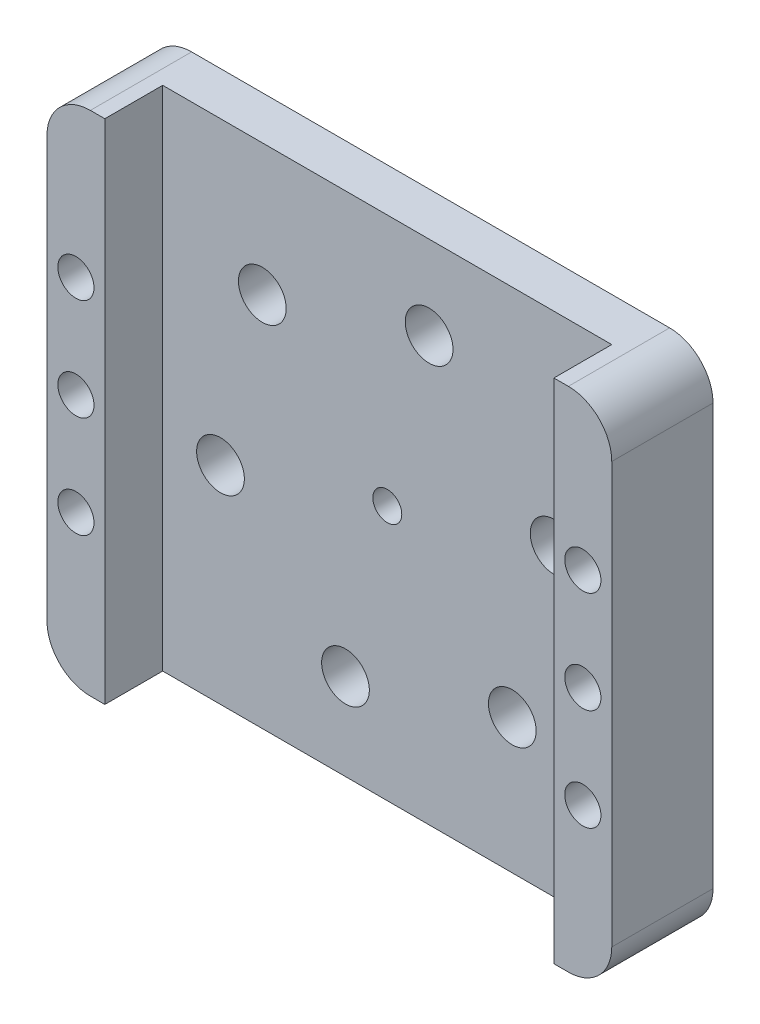
from build123d import *

# Parameters (mm, degrees)
SKETCH_3_R          = 1.65
EXTRUDE_2_DEPTH     = 3
SKETCH_4_W          = 4
SKETCH_4_H          = 35.070805957
SKETCH_4_R          = 1.25
EXTRUDE_3_DEPTH     = 4
CUT_EXTRUDE_START   = -10
SKETCH_5_R          = 1
SKETCH_5_R_2        = 1.25
CUT_EXTRUDE_1_DEPTH = 10
FILLET_1_R          = 3
FILLET_2_R          = 3
FILLET_3_R          = 3
FILLET_4_R          = 3


with BuildPart() as part:
    # 草图3 → 凸台-拉伸2 (new body)
    with BuildSketch(Plane.XY):
        Polygon((-35.565841924, 57.58934902), (-72.610989278, 57.58934902), (-73.610989278, 57.58934902), (-73.610989278, 22.518543063), (-72.610989278, 22.518543063), (-35.565841924, 22.518543063), (-34.565841924, 22.518543063), (-34.565841924, 57.58934902), align=None)
        with Locations((-56.974581146, 28.517016942)):
            Circle(SKETCH_3_R, mode=Mode.SUBTRACT)
        with Locations((-65.61538335, 36.843873328)):
            Circle(SKETCH_3_R, mode=Mode.SUBTRACT)
        with Locations((-45.44291088, 31.836742967)):
            Circle(SKETCH_3_R, mode=Mode.SUBTRACT)
        with Locations((-62.724515288, 48.490455739)):
            Circle(SKETCH_3_R, mode=Mode.SUBTRACT)
        with Locations((-42.552042818, 43.483325377)):
            Circle(SKETCH_3_R, mode=Mode.SUBTRACT)
        with Locations((-51.192845022, 51.810181763)):
            Circle(SKETCH_3_R, mode=Mode.SUBTRACT)
    extrude(amount=EXTRUDE_2_DEPTH)

    # 草图4 → 凸台-拉伸3 (add)
    # profile 1 of 2: a face of its own
    with BuildSketch(Plane.XY.offset(3)):
        with Locations((-71.610989278, 40.053946041)):
            Rectangle(SKETCH_4_W, SKETCH_4_H)
        with Locations((-71.610989278, 47.08934902)):
            Circle(SKETCH_4_R, mode=Mode.SUBTRACT)
        with Locations((-71.610989278, 33.018543063)):
            Circle(SKETCH_4_R, mode=Mode.SUBTRACT)
        with Locations((-71.610989278, 40.053946042)):
            Circle(SKETCH_4_R, mode=Mode.SUBTRACT)
    # profile 2 of 2: a face of its own
    with BuildSketch(Plane.XY.offset(3)):
        with Locations((-36.565841924, 40.053946041)):
            Rectangle(SKETCH_4_W, SKETCH_4_H)
        with Locations((-36.565841924, 47.08934902)):
            Circle(SKETCH_4_R, mode=Mode.SUBTRACT)
        with Locations((-36.565841924, 40.053946042)):
            Circle(SKETCH_4_R, mode=Mode.SUBTRACT)
        with Locations((-36.565841924, 33.018543063)):
            Circle(SKETCH_4_R, mode=Mode.SUBTRACT)
    extrude(amount=EXTRUDE_3_DEPTH)

    # 草图5 → 切除-拉伸1 (cut)
    with BuildSketch(Plane.XY.offset(3).offset(CUT_EXTRUDE_START)):
        with Locations((-54.083713084, 40.163599353)):
            Circle(SKETCH_5_R)
        with Locations((-71.610989278, 47.08934902)):
            Circle(SKETCH_5_R_2)
        with Locations((-71.610989278, 40.053946042)):
            Circle(SKETCH_5_R_2)
        with Locations((-71.610989278, 33.018543063)):
            Circle(SKETCH_5_R_2)
        with Locations((-36.565841924, 47.08934902)):
            Circle(SKETCH_5_R_2)
        with Locations((-36.565841924, 40.053946042)):
            Circle(SKETCH_5_R_2)
        with Locations((-36.565841924, 33.018543063)):
            Circle(SKETCH_5_R_2)
    extrude(amount=CUT_EXTRUDE_1_DEPTH, mode=Mode.SUBTRACT)

    # 圆角1
    fillet_1_edges = [part.edges().sort_by_distance(p)[0] for p in [
        (-73.610989278, 22.518543063, 3.5),
    ]]
    fillet(fillet_1_edges, radius=FILLET_1_R)

    # 圆角2
    fillet_2_edges = [part.edges().sort_by_distance(p)[0] for p in [
        (-73.610989278, 57.58934902, 3.5),
    ]]
    fillet(fillet_2_edges, radius=FILLET_2_R)

    # 圆角3
    fillet_3_edges = [part.edges().sort_by_distance(p)[0] for p in [
        (-34.565841924, 57.58934902, 3.5),
    ]]
    fillet(fillet_3_edges, radius=FILLET_3_R)

    # 圆角4
    fillet_4_edges = [part.edges().sort_by_distance(p)[0] for p in [
        (-34.565841924, 22.518543063, 3.5),
    ]]
    fillet(fillet_4_edges, radius=FILLET_4_R)


solid = part.part
